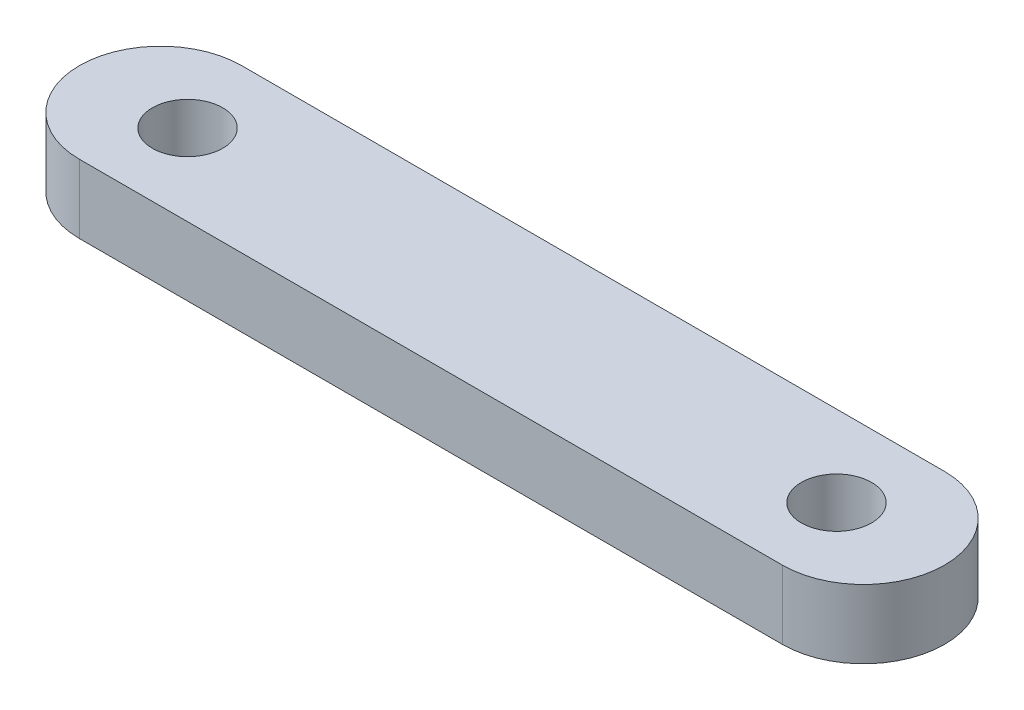
from build123d import *

# Parameters (mm, degrees)
SKETCH1_W           = 80
SKETCH1_H           = 15
BOSS_EXTRUDE1_DEPTH = 6.35
SKETCH2_R           = 3.25
CUT_EXTRUDE1_DEPTH  = 42.189470742
FILLET1_RADIUS      = 7.5
FILLET1_LENGTH      = 6.35
FILLET2_RADIUS      = 7.5
FILLET2_LENGTH      = 6.35


with BuildPart() as part:
    # Sketch1 → Boss-Extrude1 (new body)
    with BuildSketch(Plane(origin=(0, 0, 0), x_dir=(1, 0, 0), z_dir=(0, 1, 0))):
        Rectangle(SKETCH1_W, SKETCH1_H)
    extrude(amount=BOSS_EXTRUDE1_DEPTH)

    # Sketch2 → Cut-Extrude1 (cut, through all)
    with BuildSketch(Plane(origin=(0, 6.35, 0), x_dir=(1, 0, 0), z_dir=(0, 1, 0))):
        with Locations(Location((-30, 0, 0), (0, 0, 270))):
            Circle(SKETCH2_R)
        with Locations(Location((30, 0, 0), (0, 0, 270))):
            Circle(SKETCH2_R)
    extrude(amount=-CUT_EXTRUDE1_DEPTH, mode=Mode.SUBTRACT)

    # Fillet1: full round fillet: the end face becomes a half cylinder, R = half its width
    fillet1_face = Plane((-40, 3.175, 0), x_dir=(0, 1, 0), z_dir=(-1, 0, 0))  # on the end face: x along it, z out of the body
    fillet1_slab = fillet1_face.offset(-FILLET1_RADIUS / 2) * Box(FILLET1_LENGTH, 2 * FILLET1_RADIUS, FILLET1_RADIUS, mode=Mode.PRIVATE)  # the body's end, R deep
    fillet1_round = Plane((-32.5, 3.175, 0), x_dir=(-1, 0, 0), z_dir=(0, 1, 0)) * Cylinder(FILLET1_RADIUS, FILLET1_LENGTH, mode=Mode.PRIVATE)  # its axis R under the face
    add(fillet1_slab - fillet1_round, mode=Mode.SUBTRACT)

    # Fillet2: full round fillet: the end face becomes a half cylinder, R = half its width
    fillet2_face = Plane((40, 3.175, 0), x_dir=(0, -1, 0), z_dir=(1, 0, 0))  # on the end face: x along it, z out of the body
    fillet2_slab = fillet2_face.offset(-FILLET2_RADIUS / 2) * Box(FILLET2_LENGTH, 2 * FILLET2_RADIUS, FILLET2_RADIUS, mode=Mode.PRIVATE)  # the body's end, R deep
    fillet2_round = Plane((32.5, 3.175, 0), x_dir=(1, 0, 0), z_dir=(0, -1, 0)) * Cylinder(FILLET2_RADIUS, FILLET2_LENGTH, mode=Mode.PRIVATE)  # its axis R under the face
    add(fillet2_slab - fillet2_round, mode=Mode.SUBTRACT)


solid = part.part
